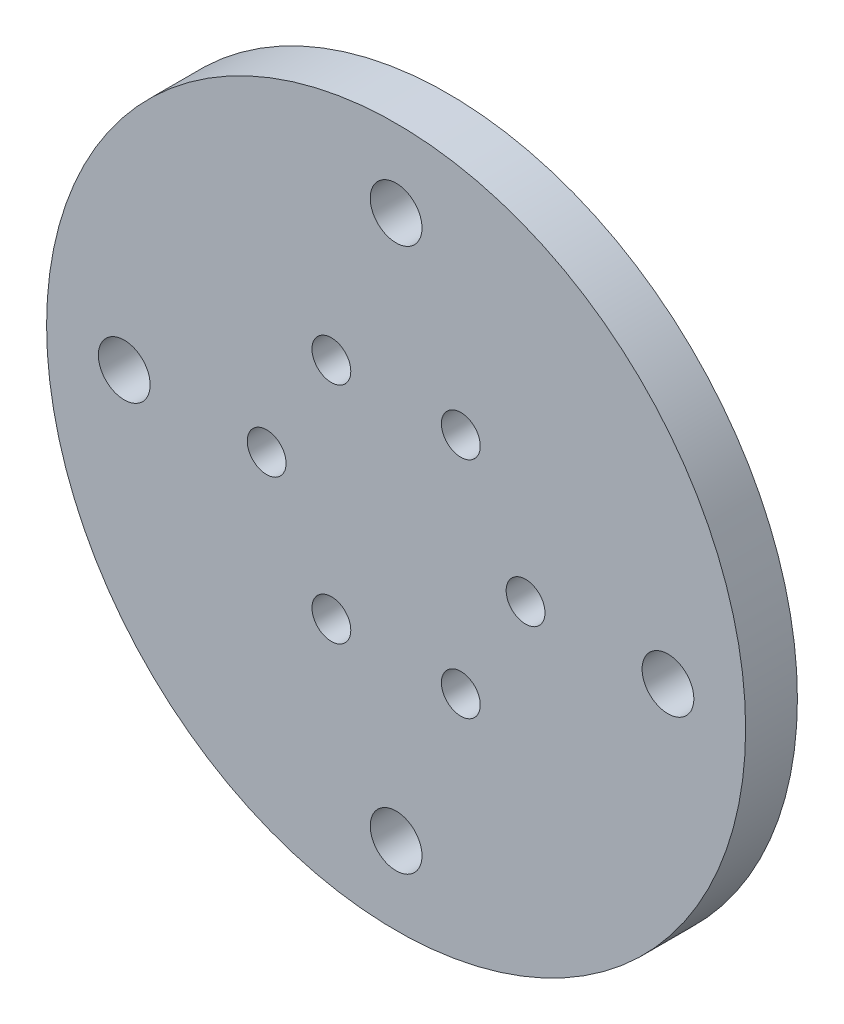
from build123d import *

# Parameters (mm, degrees)
SKETCH_1_R          = 27
EXTRUDE_1_DEPTH     = 4
SKETCH_2_R          = 1.5
SKETCH_2_R_2        = 2
CUT_EXTRUDE_1_DEPTH = 10
CHAMFER_1_SIZE      = 1


with BuildPart() as part:
    # 草图1 → 凸台-拉伸1 (new body)
    with BuildSketch(Plane.XY):
        Circle(SKETCH_1_R)
    extrude(amount=EXTRUDE_1_DEPTH)

    # 草图2 → 切除-拉伸1 (cut)
    with BuildSketch(Plane.XY.offset(4)):
        with Locations((5, 8.660254038)):
            Circle(SKETCH_2_R)
        with Locations((10, 0)):
            Circle(SKETCH_2_R)
        with Locations((5, -8.660254038)):
            Circle(SKETCH_2_R)
        with Locations((-5, -8.660254038)):
            Circle(SKETCH_2_R)
        with Locations((-10, 0)):
            Circle(SKETCH_2_R)
        with Locations((-5, 8.660254038)):
            Circle(SKETCH_2_R)
        with Locations((0, 21)):
            Circle(SKETCH_2_R_2)
        with Locations((21, 0)):
            Circle(SKETCH_2_R_2)
        with Locations((0, -21)):
            Circle(SKETCH_2_R_2)
        with Locations((-21, 0)):
            Circle(SKETCH_2_R_2)
    extrude(amount=-CUT_EXTRUDE_1_DEPTH, mode=Mode.SUBTRACT)

    # 倒角1
    chamfer_1_edges = [part.edges().sort_by_distance(p)[0] for p in [
        (-23, 0, 0),
        (-2, 21, 0),
        (19, 0, 0),
        (-2, -21, 0),
    ]]
    chamfer(chamfer_1_edges, length=CHAMFER_1_SIZE)


solid = part.part
